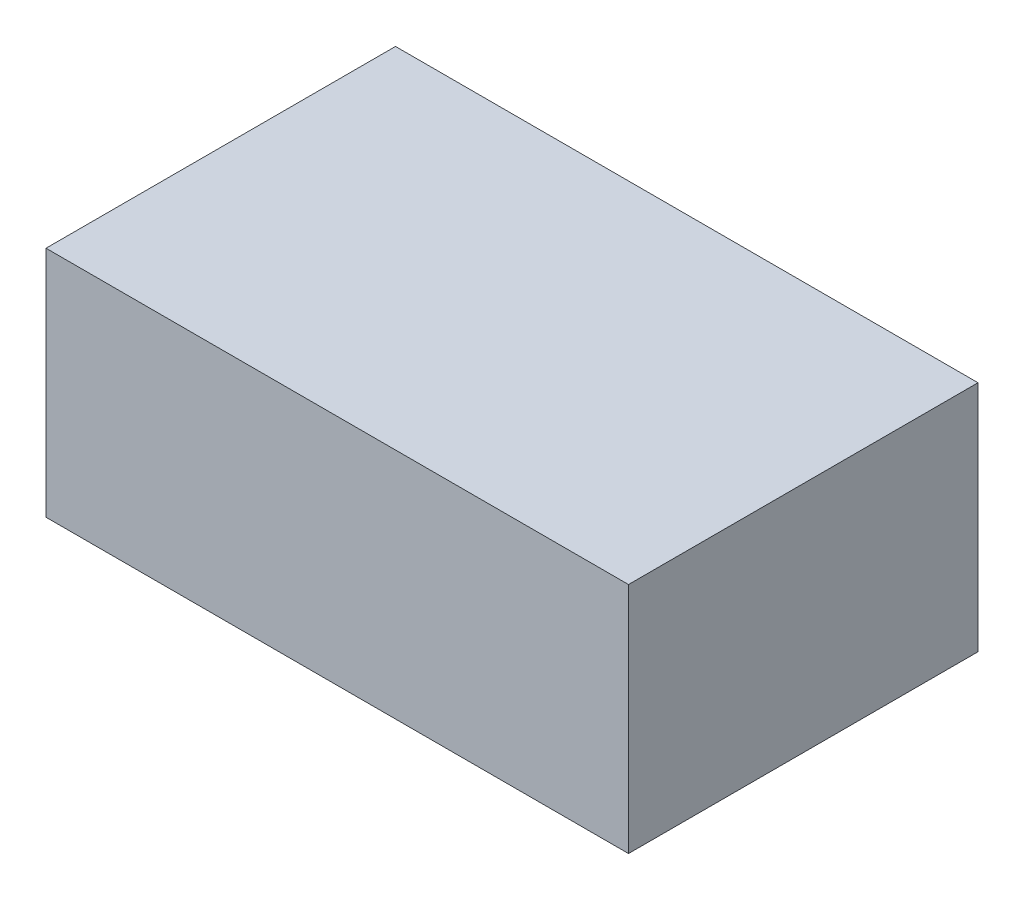
from build123d import *

# Parameters (mm, degrees)
SKETCH1_W           = 254
SKETCH1_H           = 152.4
BOSS_EXTRUDE1_DEPTH = 101.6


with BuildPart() as part:
    # Sketch1 → Boss-Extrude1 (new body)
    with BuildSketch(Plane(origin=(0, 0, 0), x_dir=(1, 0, 0), z_dir=(0, 1, 0))):
        Rectangle(SKETCH1_W, SKETCH1_H)
    extrude(amount=BOSS_EXTRUDE1_DEPTH)


solid = part.part
